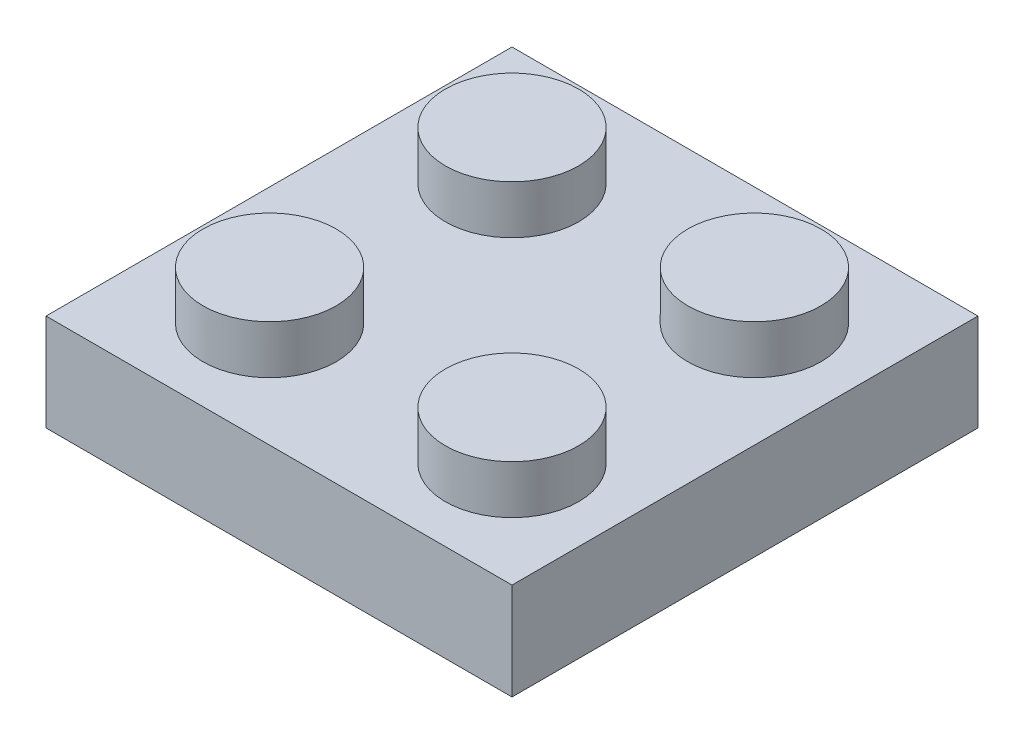
from build123d import *

# Parameters (mm, degrees)
BASEFRAMESKETCH_W           = 15.38
BASEFRAMESKETCH_H           = 3.2
BASEFRAME_DEPTH             = 7.69
STUDSSKETCH_R               = 2.197938665
STUDS_DEPTH                 = 1.6
MAINSTUDSPATTERN_COUNT      = 2
MAINSTUDSPATTERN_PITCH      = 8
MAINSTUDSPATTERN_COUNT_DIR2 = 2
MAINSTUDSPATTERN_PITCH_DIR2 = 8
MAINBASESHELL_T             = -1.2
UNDERCIRCLESKETCH_R         = 3.25
UNDERCIRCLESKETCH_R_2       = 2.4
UNDERCIRCLEEXTRUDE_DEPTH    = 1.8
SMALLUNDERSIDEHOLEX_REACH   = 17.429
HOLEXSKETCH_R               = 1.25
HOLEXSKETCH_R_2             = 0.75
SMALLUNDERSIDEHOLEY_REACH   = 17.429
HOLEYSKETCH_R               = 1.25
HOLEYSKETCH_R_2             = 0.75


with BuildPart() as part:
    # BaseFrameSketch → BaseFrame (new, symmetric)
    with BuildSketch(Plane.XY):
        with Locations((-4.794729064, 1.6)):
            Rectangle(BASEFRAMESKETCH_W, BASEFRAMESKETCH_H)
    extrude(amount=BASEFRAME_DEPTH, both=True)

    # StudsSketch → Studs (add)
    with BuildSketch(Plane(origin=(0, 3.2, 0), x_dir=(1, 0, 0), z_dir=(0, 1, 0))):
        with Locations((-8.584729064, 3.79)):
            Circle(STUDSSKETCH_R)
    studs = extrude(amount=STUDS_DEPTH)

    # MainStudsPattern: Studs 2 × 2
    with Locations(*[(i * MAINSTUDSPATTERN_PITCH, 0, j * MAINSTUDSPATTERN_PITCH_DIR2) for i in range(MAINSTUDSPATTERN_COUNT) for j in range(MAINSTUDSPATTERN_COUNT_DIR2) if (i, j) != (0, 0)]):
        add(studs)

    # MainBaseShell
    mainbaseshell_openings = [part.faces().sort_by_distance(p)[0] for p in [
        (-4.794729064, 0, 0),
    ]]
    offset(amount=MAINBASESHELL_T, openings=mainbaseshell_openings, kind=Kind.INTERSECTION)

    # UnderCircleSketch → UnderCircleExtrude (add)
    with BuildSketch(Plane(origin=(0, 2, 0), x_dir=(-1, 0, 0), z_dir=(0, -1, 0))):
        with Locations(Location((4.794729064, 0, 0), (0, 0, 270))):
            Circle(UNDERCIRCLESKETCH_R)
        with Locations(Location((4.794729064, 0, 0), (0, 0, 270))):
            Circle(UNDERCIRCLESKETCH_R_2, mode=Mode.SUBTRACT)
    extrude(amount=UNDERCIRCLEEXTRUDE_DEPTH)

    # HoleXSketch → SmallUnderSideHoleX (add, up to next)
    with BuildSketch(Plane(origin=(0, 0, 0), x_dir=(-1, 0, 0), z_dir=(0, -1, 0)), mode=Mode.PRIVATE) as smallundersideholex_sk1:
        with Locations(Location((4.584729064, 3.79, 0), (0, 0, 90))):
            Circle(HOLEXSKETCH_R)
        with Locations(Location((4.584729064, 3.79, 0), (0, 0, 90))):
            Circle(HOLEXSKETCH_R_2, mode=Mode.SUBTRACT)
    smallundersideholex_tool1 = extrude(smallundersideholex_sk1.sketch, amount=-SMALLUNDERSIDEHOLEX_REACH, mode=Mode.PRIVATE) - part.part
    add(smallundersideholex_tool1.solids().sort_by_distance((-4.584729, 0, -2.575355))[0])

    # HoleYSketch → SmallUnderSideHoleY (add, up to next)
    with BuildSketch(Plane(origin=(0, 0, 0), x_dir=(-1, 0, 0), z_dir=(0, -1, 0)), mode=Mode.PRIVATE) as smallundersideholey_sk1:
        with Locations(Location((8.584729064, -0.21, 0), (0, 0, 90))):
            Circle(HOLEYSKETCH_R)
        with Locations(Location((8.584729064, -0.21, 0), (0, 0, 90))):
            Circle(HOLEYSKETCH_R_2, mode=Mode.SUBTRACT)
    smallundersideholey_tool1 = extrude(smallundersideholey_sk1.sketch, amount=-SMALLUNDERSIDEHOLEY_REACH, mode=Mode.PRIVATE) - part.part
    add(smallundersideholey_tool1.solids().sort_by_distance((-8.584729, 0, 1.424645))[0])


solid = part.part
